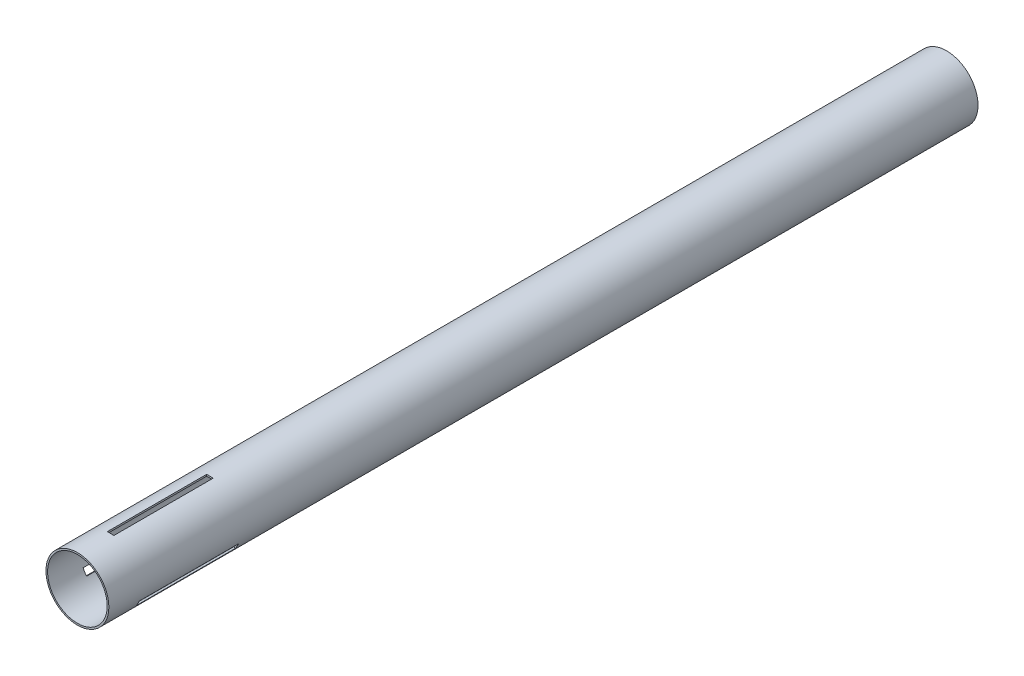
from build123d import *

# Parameters (mm, degrees)
SKETCH1_R               = 19
SKETCH1_R_2             = 18
BOSS_EXTRUDE1_DEPTH     = 525
CUT_EXTRUDE1_REACH      = 528.716
CUT_EXTRUDE1_END_RADIUS = 18
SKETCH2_W               = 4
SKETCH2_H               = 60
CIRPATTERN1_COUNT       = 3


with BuildPart() as part:
    # Sketch1 → Boss-Extrude1 (new body)
    with BuildSketch(Plane.XY):
        Circle(SKETCH1_R)
        Circle(SKETCH1_R_2, mode=Mode.SUBTRACT)
    extrude(amount=BOSS_EXTRUDE1_DEPTH)

    # Cut-Extrude1: up to this cylinder (the profile starts outside it)
    cut_extrude1_end = Plane(origin=(0, 0, 475), z_dir=(0, 0, -1)) * Cylinder(CUT_EXTRUDE1_END_RADIUS, 1094.432, mode=Mode.PRIVATE)
    # Sketch2 → Cut-Extrude1 (cut, up to the surface)
    with BuildSketch(Plane(origin=(0, 19, 0), x_dir=(1, 0, 0), z_dir=(0, 1, 0)), mode=Mode.PRIVATE) as cut_extrude1_sk1:
        with Locations((0, -475)):
            Rectangle(SKETCH2_W, SKETCH2_H)
    cut_extrude1_tool1 = extrude(cut_extrude1_sk1.sketch, amount=-CUT_EXTRUDE1_REACH, mode=Mode.PRIVATE) - cut_extrude1_end
    cut_extrude1 = cut_extrude1_tool1.solids().sort_by_distance((0, 19, 475))[0]
    add(cut_extrude1, mode=Mode.SUBTRACT)

    # CirPattern1: Cut-Extrude1 ×3 about axis
    cirpattern1_axis = Axis((0, 0, 0), (0, 0, 1))
    for i in range(1, CIRPATTERN1_COUNT):
        add(cut_extrude1.rotate(cirpattern1_axis, i * 360 / CIRPATTERN1_COUNT), mode=Mode.SUBTRACT)


solid = part.part
